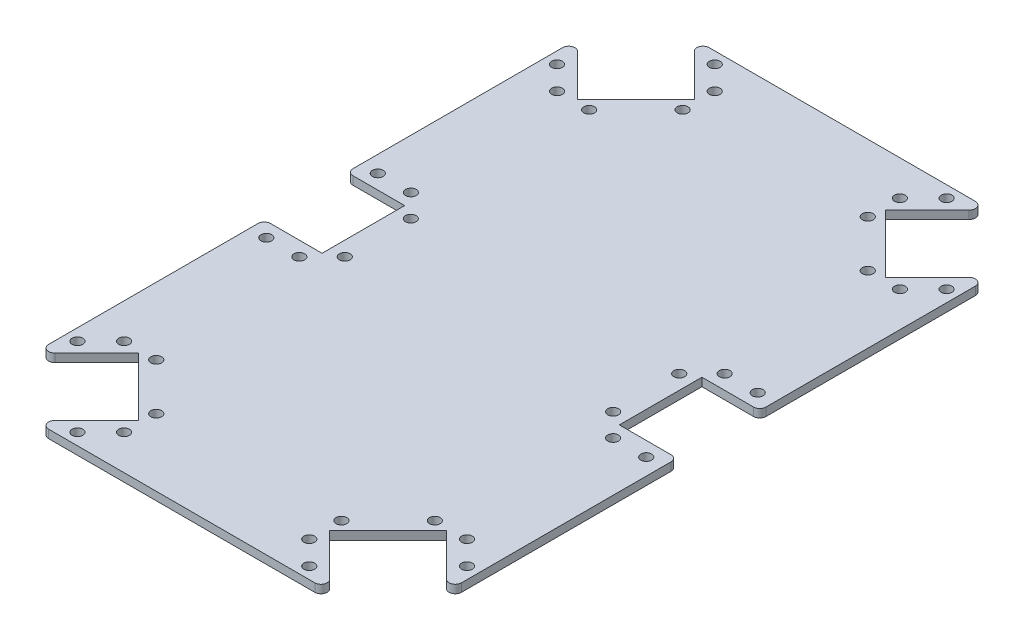
from build123d import *

# Parameters (mm, degrees)
SKETCH2_W           = 100
SKETCH2_H           = 160
SKETCH2_R           = 1.3
BOSS_EXTRUDE1_DEPTH = 2
SKETCH3_W           = 14
SKETCH3_H           = 20
CUT_EXTRUDE1_DEPTH  = 2
FILLET1_R           = 1.5


with BuildPart() as part:
    # Sketch2 → Boss-Extrude1 (new body)
    with BuildSketch(Plane(origin=(0, 0, 0), x_dir=(1, 0, 0), z_dir=(0, 1, 0))):
        Rectangle(SKETCH2_W, SKETCH2_H)
        with Locations(Location((22.422835534, 63.736544033, 0), (0, 0, 270))):
            Circle(SKETCH2_R, mode=Mode.SUBTRACT)
        with Locations(Location((22.422835534, 71.514718626, 0), (0, 0, 270))):
            Circle(SKETCH2_R, mode=Mode.SUBTRACT)
        with Locations(Location((28.079689783, 77.171572875, 0), (0, 0, 270))):
            Circle(SKETCH2_R, mode=Mode.SUBTRACT)
        with Locations(Location((46, 13.5, 0), (0, 0, 270))):
            Circle(SKETCH2_R, mode=Mode.SUBTRACT)
        with Locations(Location((38, 13.5, 0), (0, 0, 270))):
            Circle(SKETCH2_R, mode=Mode.SUBTRACT)
        with Locations(Location((32.5, 8, 0), (0, 0, 270))):
            Circle(SKETCH2_R, mode=Mode.SUBTRACT)
        with Locations(Location((32.5, -8, 0), (0, 0, 90))):
            Circle(SKETCH2_R, mode=Mode.SUBTRACT)
        with Locations(Location((38, -13.5, 0), (0, 0, 90))):
            Circle(SKETCH2_R, mode=Mode.SUBTRACT)
        with Locations(Location((46, -13.5, 0), (0, 0, 90))):
            Circle(SKETCH2_R, mode=Mode.SUBTRACT)
        with Locations(Location((47.171572875, 58.079689783, 0), (0, 0, 90))):
            Circle(SKETCH2_R, mode=Mode.SUBTRACT)
        with Locations(Location((41.514718626, 52.422835534, 0), (0, 0, 90))):
            Circle(SKETCH2_R, mode=Mode.SUBTRACT)
        with Locations(Location((33.736544033, 52.422835534, 0), (0, 0, 90))):
            Circle(SKETCH2_R, mode=Mode.SUBTRACT)
        with Locations(Location((47.171572875, -58.079689783, 0), (0, 0, 270))):
            Circle(SKETCH2_R, mode=Mode.SUBTRACT)
        with Locations(Location((41.514718626, -52.422835534, 0), (0, 0, 270))):
            Circle(SKETCH2_R, mode=Mode.SUBTRACT)
        with Locations(Location((33.736544033, -52.422835534, 0), (0, 0, 270))):
            Circle(SKETCH2_R, mode=Mode.SUBTRACT)
        with Locations(Location((28.079689783, -77.171572875, 0), (0, 0, 90))):
            Circle(SKETCH2_R, mode=Mode.SUBTRACT)
        with Locations(Location((22.422835534, -71.514718626, 0), (0, 0, 90))):
            Circle(SKETCH2_R, mode=Mode.SUBTRACT)
        with Locations(Location((22.422835534, -63.736544033, 0), (0, 0, 90))):
            Circle(SKETCH2_R, mode=Mode.SUBTRACT)
        with Locations(Location((-28.079689783, 77.171572875, 0), (0, 0, 90))):
            Circle(SKETCH2_R, mode=Mode.SUBTRACT)
        with Locations(Location((-22.422835534, 71.514718626, 0), (0, 0, 90))):
            Circle(SKETCH2_R, mode=Mode.SUBTRACT)
        with Locations(Location((-22.422835534, 63.736544033, 0), (0, 0, 90))):
            Circle(SKETCH2_R, mode=Mode.SUBTRACT)
        with Locations(Location((-47.171572875, 58.079689783, 0), (0, 0, 270))):
            Circle(SKETCH2_R, mode=Mode.SUBTRACT)
        with Locations(Location((-41.514718626, 52.422835534, 0), (0, 0, 270))):
            Circle(SKETCH2_R, mode=Mode.SUBTRACT)
        with Locations(Location((-33.736544033, 52.422835534, 0), (0, 0, 270))):
            Circle(SKETCH2_R, mode=Mode.SUBTRACT)
        with Locations(Location((-47.171572875, -58.079689783, 0), (0, 0, 90))):
            Circle(SKETCH2_R, mode=Mode.SUBTRACT)
        with Locations(Location((-41.514718626, -52.422835534, 0), (0, 0, 90))):
            Circle(SKETCH2_R, mode=Mode.SUBTRACT)
        with Locations(Location((-33.736544033, -52.422835534, 0), (0, 0, 90))):
            Circle(SKETCH2_R, mode=Mode.SUBTRACT)
        with Locations(Location((-22.422835534, -63.736544033, 0), (0, 0, 270))):
            Circle(SKETCH2_R, mode=Mode.SUBTRACT)
        with Locations(Location((-22.422835534, -71.514718626, 0), (0, 0, 270))):
            Circle(SKETCH2_R, mode=Mode.SUBTRACT)
        with Locations(Location((-28.079689783, -77.171572875, 0), (0, 0, 270))):
            Circle(SKETCH2_R, mode=Mode.SUBTRACT)
        with Locations(Location((-32.5, -8, 0), (0, 0, 270))):
            Circle(SKETCH2_R, mode=Mode.SUBTRACT)
        with Locations(Location((-38, -13.5, 0), (0, 0, 270))):
            Circle(SKETCH2_R, mode=Mode.SUBTRACT)
        with Locations(Location((-46, -13.5, 0), (0, 0, 270))):
            Circle(SKETCH2_R, mode=Mode.SUBTRACT)
        with Locations(Location((-46, 13.5, 0), (0, 0, 90))):
            Circle(SKETCH2_R, mode=Mode.SUBTRACT)
        with Locations(Location((-38, 13.5, 0), (0, 0, 90))):
            Circle(SKETCH2_R, mode=Mode.SUBTRACT)
        with Locations(Location((-32.5, 8, 0), (0, 0, 90))):
            Circle(SKETCH2_R, mode=Mode.SUBTRACT)
    extrude(amount=BOSS_EXTRUDE1_DEPTH)

    # Sketch3 → Cut-Extrude1 (cut)
    with BuildSketch(Plane(origin=(0, 2, 0), x_dir=(1, 0, 0), z_dir=(0, 1, 0))):
        with Locations((43, 0)):
            Rectangle(SKETCH3_W, SKETCH3_H)
        Polygon((35.857864376, 80), (23.129942315, 67.272077939), (37.272077939, 53.129942315), (50, 65.857864376), (50, 80), align=None)
        Polygon((50, -65.857864376), (50, -80), (35.857864376, -80), (23.129942315, -67.272077939), (37.272077939, -53.129942315), align=None)
        Polygon((-50, 65.857864376), (-50, 80), (-35.857864376, 80), (-23.129942315, 67.272077939), (-37.272077939, 53.129942315), align=None)
        with Locations((-43, 0)):
            Rectangle(SKETCH3_W, SKETCH3_H)
        Polygon((-37.272077939, -53.129942315), (-50, -65.857864376), (-50, -80), (-35.857864376, -80), (-23.129942315, -67.272077939), align=None)
    extrude(amount=-CUT_EXTRUDE1_DEPTH, mode=Mode.SUBTRACT)

    # Fillet1
    fillet1_edges = [part.edges().sort_by_distance(p)[0] for p in [
        (35.857864376, 1, -80),
        (50, 1, -65.857864376),
        (50, 1, 65.857864376),
        (35.857864376, 1, 80),
        (-50, 1, -65.857864376),
        (-35.857864376, 1, -80),
        (-50, 1, 10),
        (-50, 1, -10),
        (-35.857864376, 1, 80),
        (-50, 1, 65.857864376),
        (50, 1, -10),
        (50, 1, 10),
    ]]
    fillet(fillet1_edges, radius=FILLET1_R)


solid = part.part
